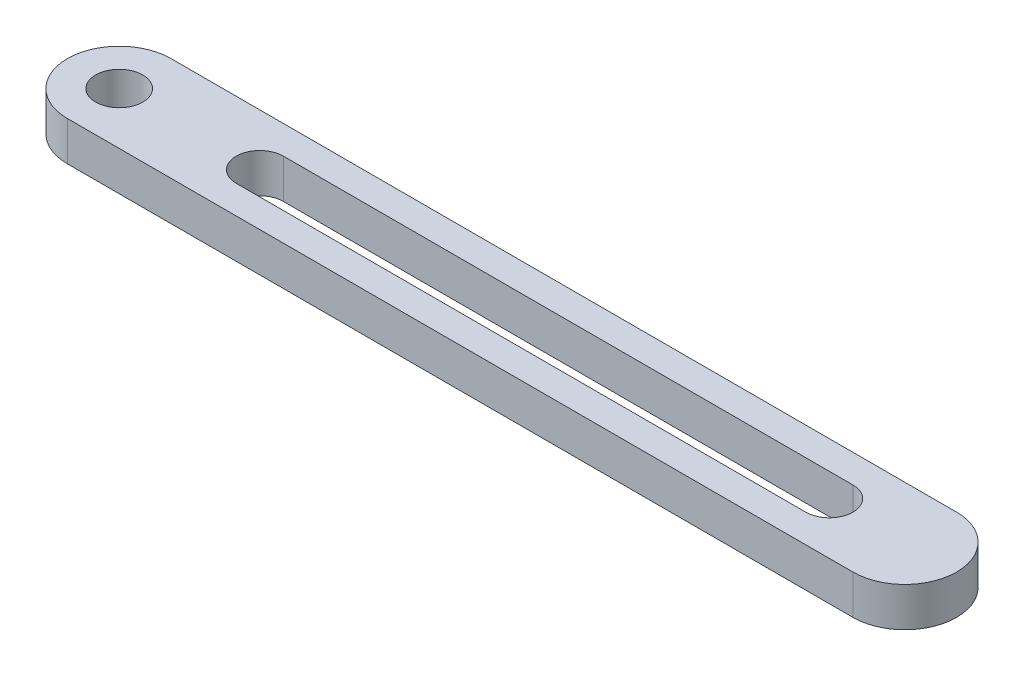
from build123d import *

# Parameters (mm, degrees)
SKETCH1_R           = 7.62
BOSS_EXTRUDE1_DEPTH = 12.7
CUT_EXTRUDE1_DEPTH  = 45.974


with BuildPart() as part:
    # Sketch1 → Boss-Extrude1 (new body)
    with BuildSketch(Plane(origin=(0, 0, 0), x_dir=(1, 0, 0), z_dir=(0, 1, 0))):
        with BuildLine():
            Line((0, 16.764), (254, 16.764))
            ThreePointArc((254, 16.764), (270.764, 0), (254, -16.764))
            Line((254, -16.764), (0, -16.764))
            ThreePointArc((0, -16.764), (-16.764, 0), (0, 16.764))
        make_face()
        with Locations(Location((0, 0, 0), (0, 0, 270))):
            Circle(SKETCH1_R, mode=Mode.SUBTRACT)
    extrude(amount=BOSS_EXTRUDE1_DEPTH)

    # Sketch3 → Cut-Extrude1 (cut)
    with BuildSketch(Plane(origin=(0, 12.7, 0), x_dir=(1, 0, 0), z_dir=(0, 1, 0))):
        with BuildLine():
            ThreePointArc((45.466, 7.62), (37.846, 0), (45.466, -7.62))
            Line((45.466, -7.62), (102.616, -7.62))
            Line((102.616, -7.62), (229.616, -7.62))
            ThreePointArc((229.616, -7.62), (237.236, 0), (229.616, 7.62))
            Line((229.616, 7.62), (167.898503034, 7.62))
            Line((167.898503034, 7.62), (45.466, 7.62))
        make_face()
    extrude(amount=-CUT_EXTRUDE1_DEPTH, mode=Mode.SUBTRACT)


solid = part.part
